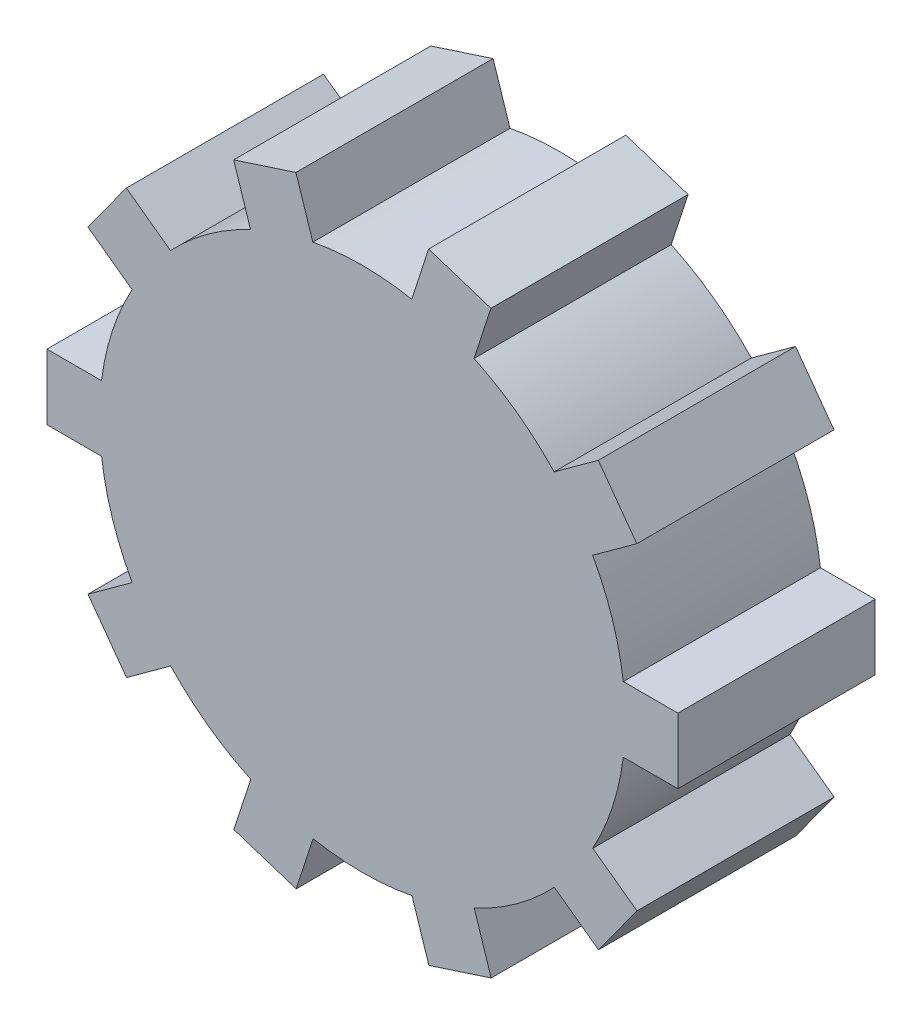
from build123d import *

# Parameters (mm, degrees)
SKETCH_1_R               = 20
EXTRUDE_1_DEPTH          = 15
SKETCH_2_W               = 4.154442466
SKETCH_2_H               = 4.980694692
EXTRUDE_2_DEPTH          = 15
PATTERN_CIRCULAR_1_COUNT = 10


with BuildPart() as part:
    # 草图1 → 凸台-拉伸1 (new body)
    with BuildSketch(Plane.XY):
        Circle(SKETCH_1_R)
    extrude(amount=EXTRUDE_1_DEPTH)

    # 草图2 → 凸台-拉伸2 (add)
    with BuildSketch(Plane.XY):
        with Locations((21.922778767, 0.009652654)):
            Rectangle(SKETCH_2_W, SKETCH_2_H)
    extrude_2 = extrude(amount=EXTRUDE_2_DEPTH)

    # 阵列(圆周)1: 凸台-拉伸2 ×10 about axis
    pattern_circular_1_axis = Axis((0, 0, 15), (0, 0, -1))
    for i in range(1, PATTERN_CIRCULAR_1_COUNT):
        add(extrude_2.rotate(pattern_circular_1_axis, i * 360 / PATTERN_CIRCULAR_1_COUNT))


solid = part.part
